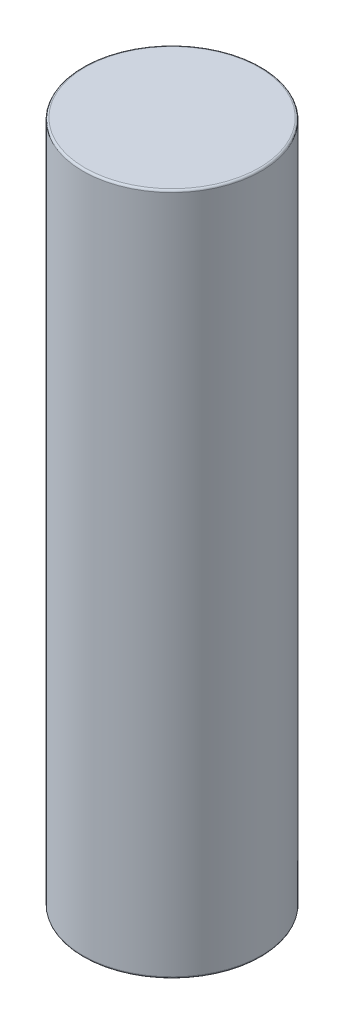
from build123d import *

# Parameters (mm, degrees)
CROQUIS1_R              = 9
SALIENTE_EXTRUIR1_DEPTH = 69
REDONDEO1_R             = 0.2


with BuildPart() as part:
    # Croquis1 → Saliente-Extruir1 (new body)
    with BuildSketch(Plane(origin=(0, 0, 0), x_dir=(1, 0, 0), z_dir=(0, 1, 0))):
        with Locations(Location((0, 0, 0), (0, 0, 270))):
            Circle(CROQUIS1_R)
    extrude(amount=SALIENTE_EXTRUIR1_DEPTH)

    # Redondeo1
    redondeo1_edges = [part.edges().sort_by_distance(p)[0] for p in [
        (0, 0, -9),
        (0, 69, -9),
    ]]
    fillet(redondeo1_edges, radius=REDONDEO1_R)


solid = part.part
